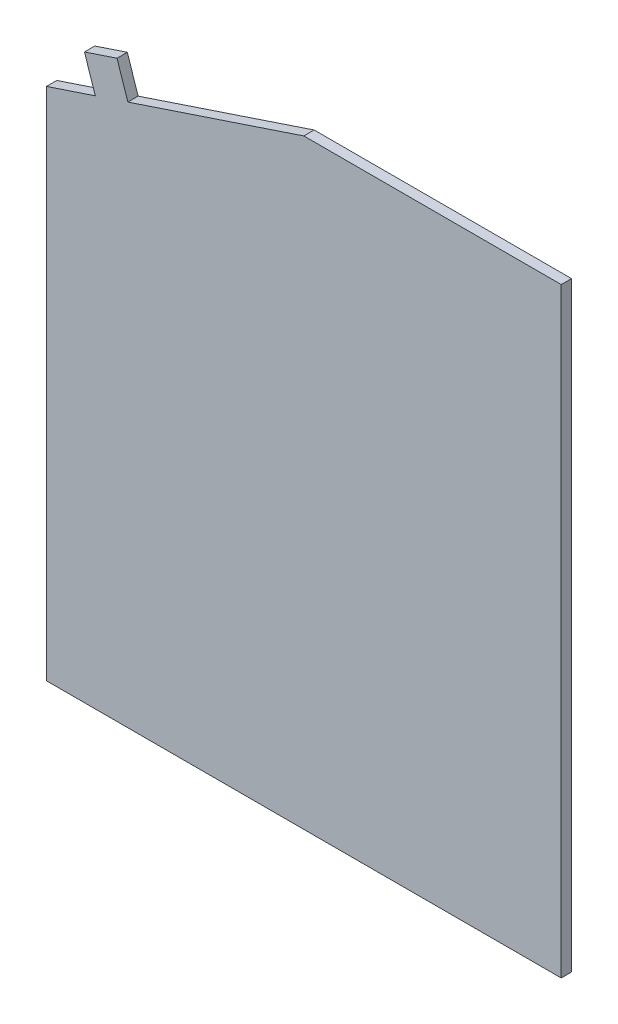
from build123d import *

# Parameters (mm, degrees)
BOSS_EXTRU_1_DEPTH = 3


with BuildPart() as part:
    # Esquisse1 → Boss.-Extru.1 (new body)
    with BuildSketch(Plane.XY):
        Polygon((0, 0), (150, 0), (150, 175), (75, 175), (23.717082451, 157.90569415), (20.554804791, 167.392527131), (11.067971811, 164.230249471), (14.230249471, 154.74341649), (0, 150), align=None)
    extrude(amount=BOSS_EXTRU_1_DEPTH)


solid = part.part
